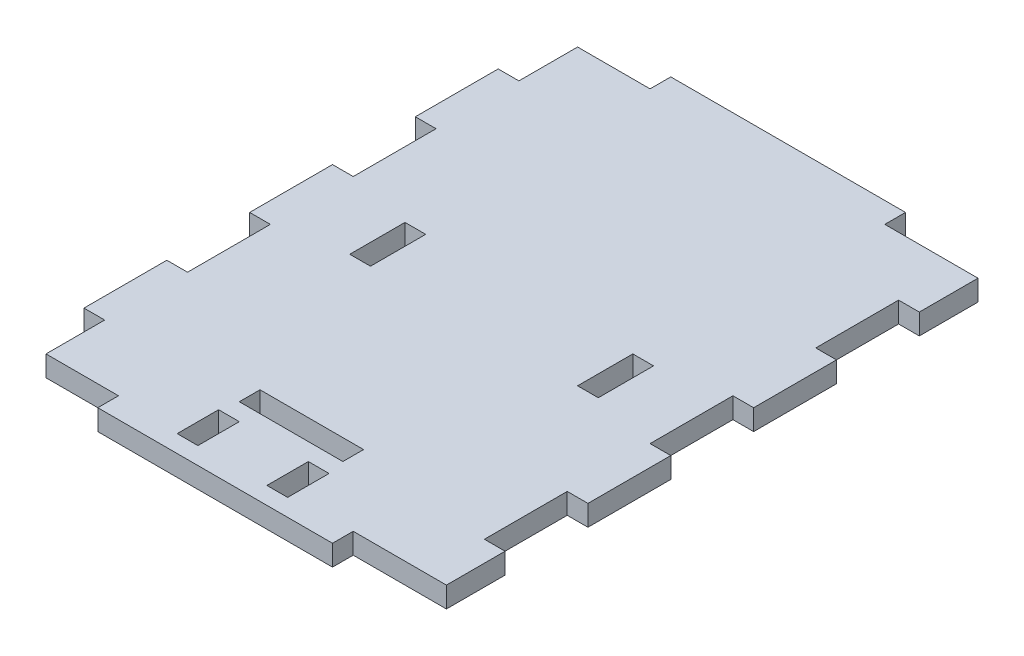
from build123d import *

# Parameters (mm, degrees)
SALIENTE_EXTRUIR1_DEPTH = 3
CORTAR_EXTRUIR1_DEPTH   = 10


with BuildPart() as part:
    # Croquis1 → Saliente-Extruir1 (new body)
    with BuildSketch(Plane(origin=(0, 0, 0), x_dir=(1, 0, 0), z_dir=(0, 1, 0))):
        Polygon((3, 35.5), (0, 35.5), (0, 47.5), (3, 47.5), (3, 59.5), (0, 59.5), (0, 71.5), (3, 71.5), (3, 80), (13.5, 80), (13.5, 83), (47.5, 83), (47.5, 80), (61, 80), (61, 71.5), (58, 71.5), (58, 59.5), (61, 59.5), (61, 47.5), (58, 47.5), (58, 35.5), (61, 35.5), (61, 23.5), (58, 23.5), (58, 11.5), (61, 11.5), (61, 3), (47.5, 3), (47.5, 0), (13.5, 0), (13.5, 3), (3, 3), (3, 11.5), (0, 11.5), (0, 23.5), (3, 23.5), align=None)
    extrude(amount=SALIENTE_EXTRUIR1_DEPTH)

    # Croquis2 → Cortar-Extruir1 (cut)
    with BuildSketch(Plane(origin=(0, 3, 0), x_dir=(1, 0, 0), z_dir=(0, 1, 0))):
        Polygon((15.5, 41.5), (15.5, 45.5), (12.5, 45.5), (12.5, 37.5), (15.5, 37.5), align=None)
        Polygon((45.5, 37.5), (45.5, 41.5), (45.5, 45.5), (48.5, 45.5), (48.5, 37.5), align=None)
        Polygon((30.5, 14), (23, 14), (23, 11), (25, 11), (38, 11), (38, 14), align=None)
        Polygon((35.5, 8.5), (35.5, 2.5), (38.5, 2.5), (38.5, 5.5), (38.5, 8.5), align=None)
        Polygon((22.5, 5.5), (22.5, 8.5), (25.5, 8.5), (25.5, 2.5), (22.5, 2.5), align=None)
    extrude(amount=-CORTAR_EXTRUIR1_DEPTH, mode=Mode.SUBTRACT)


solid = part.part
